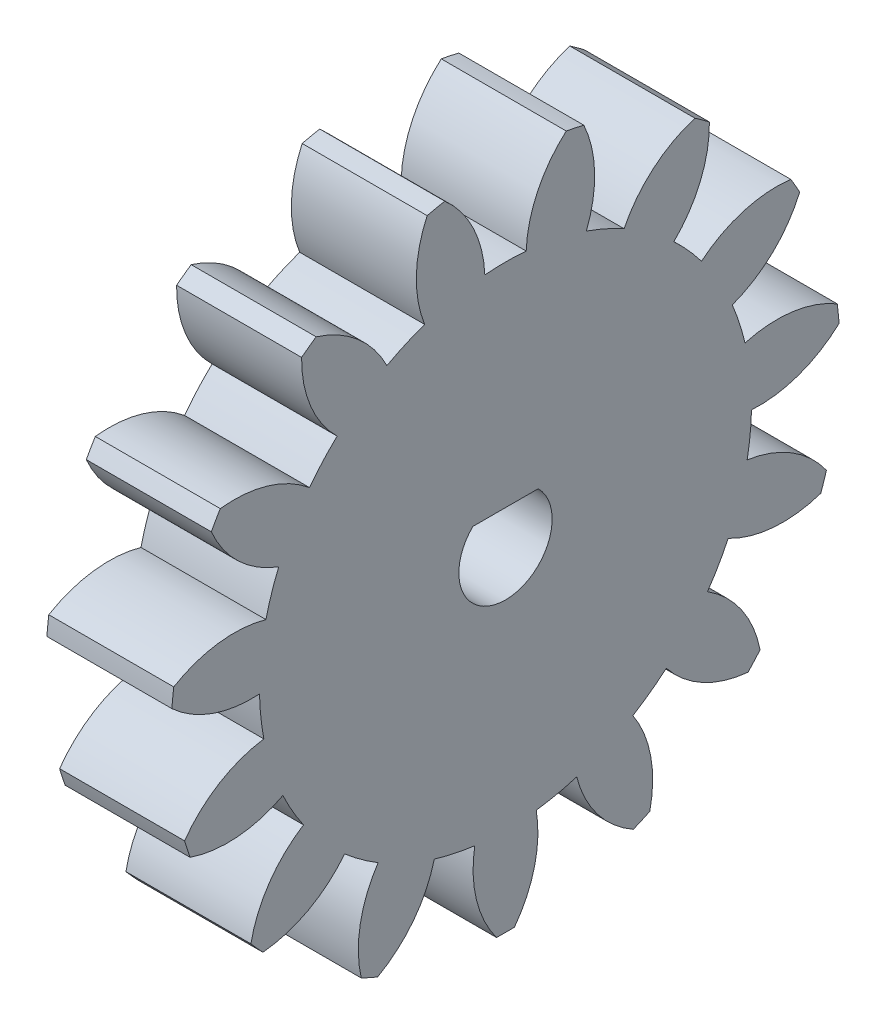
from build123d import *

# Parameters (mm, degrees)
BASPROSKE_W        = 6.35
BASPROSKE_H        = 17
TOOTHCUT_DEPTH     = 25.86609137
TEETHCUTS_COUNT    = 15
BORSKE_R           = 0.4
BORE_DEPTH         = 50.0000508
CUT_EXTRUDE1_DEPTH = 25.830915598


with BuildPart() as part:
    # BasProSke → Base-Revolve (revolve)
    with BuildSketch(Plane(origin=(0, 0, 0), x_dir=(1, 0, 0), z_dir=(0, 1, 0)), mode=Mode.PRIVATE) as base_revolve_sk:
        with Locations((3.175, 8.5)):
            Rectangle(BASPROSKE_W, BASPROSKE_H)
    revolve(base_revolve_sk.sketch.rotate(Axis((-10, 0, 0), (1, 0, 0)), 180), axis=Axis((-10, 0, 0), (1, 0, 0)))

    # TooCutSke → ToothCut (cut, through all)
    with BuildSketch(Plane(origin=(0, 0, 0), x_dir=(0, 0, -1), z_dir=(1, 0, 0))):
        with BuildLine():
            ThreePointArc((1.050056448, 12.454813626), (0, 12.499), (-1.050056448, 12.454813626))
            ThreePointArc((-1.050056448, 12.454813626), (-1.638118106, 14.809604533), (-3.110934279, 16.73876737))
            ThreePointArc((-3.110934279, 16.73876737), (0, 17.0254), (3.110934279, 16.73876737))
            ThreePointArc((3.110934279, 16.73876737), (1.638118106, 14.809604533), (1.050056448, 12.454813626))
        make_face()
    toothcut = extrude(amount=TOOTHCUT_DEPTH, mode=Mode.SUBTRACT)

    # TeethCuts: ToothCut ×15 about axis
    teethcuts_axis = Axis((0, 0, 0), (1, 0, 0))
    for i in range(1, TEETHCUTS_COUNT):
        add(toothcut.rotate(teethcuts_axis, i * 360 / TEETHCUTS_COUNT), mode=Mode.SUBTRACT)

    # BorSke → Bore (cut, symmetric)
    with BuildSketch(Plane(origin=(0, 0, 0), x_dir=(0, 0, -1), z_dir=(1, 0, 0))):
        with Locations(Location((0, 0, 0), (0, 0, 180))):
            Circle(BORSKE_R)
    extrude(amount=BORE_DEPTH, both=True, mode=Mode.SUBTRACT)

    # Sketch1 → Cut-Extrude1 (cut, through all)
    with BuildSketch(Plane.ZY):
        with BuildLine():
            Line((1.659895813, 1.69164), (-1.659895813, 1.69164))
            ThreePointArc((-1.659895813, 1.69164), (-0.917318626, -2.185274934), (2.37, 0))
            ThreePointArc((2.37, 0), (2.185274934, 0.917318626), (1.659895813, 1.69164))
        make_face()
    extrude(amount=-CUT_EXTRUDE1_DEPTH, mode=Mode.SUBTRACT)


solid = part.part
